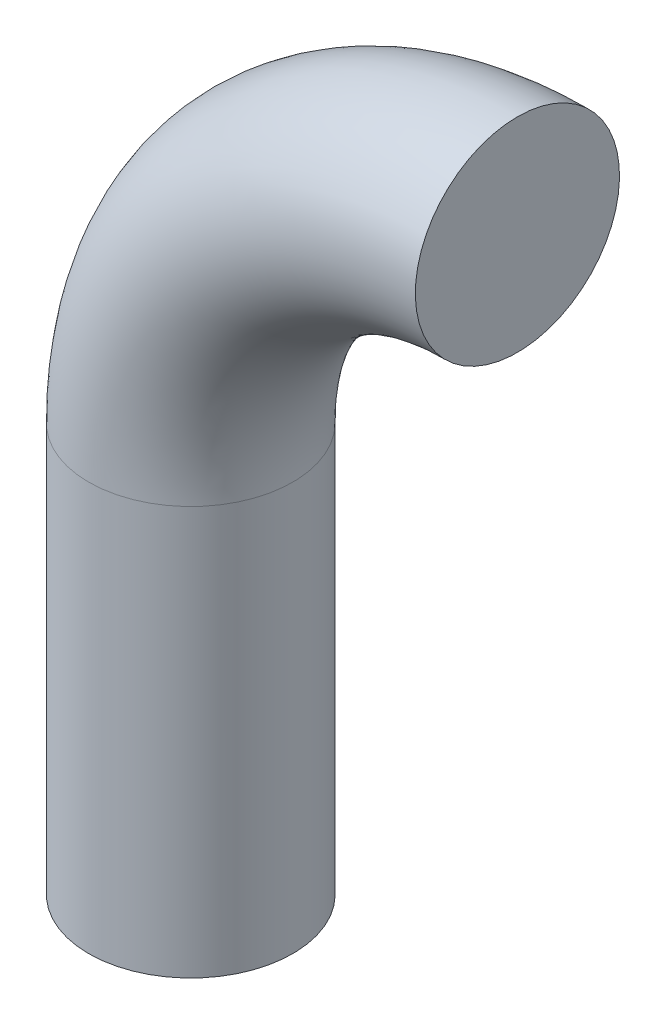
from build123d import *

# Parameters (mm, degrees)
SKETCH2_R = 25
SHELL1_T  = -3


with BuildPart() as part:
    # Sweep1: sweep along a path in Sketch1
    with BuildLine(Plane.XY) as sweep1_path:
        Line((0, 0), (0, 100))
        ThreePointArc((0, 100), (23.431457505, 156.568542495), (80, 180))
    # Sketch2 → Sweep1 (sweep)
    with BuildSketch(Plane(origin=(0, 0, 0), x_dir=(1, 0, 0), z_dir=(0, 1, 0))):
        Circle(SKETCH2_R)
    sweep(path=sweep1_path.line)

    # Shell1
    shell1_openings = [part.faces().sort_by_distance(p)[0] for p in [
        (0, 0, 0),
    ]]
    offset(amount=SHELL1_T, openings=shell1_openings, kind=Kind.INTERSECTION)


solid = part.part
